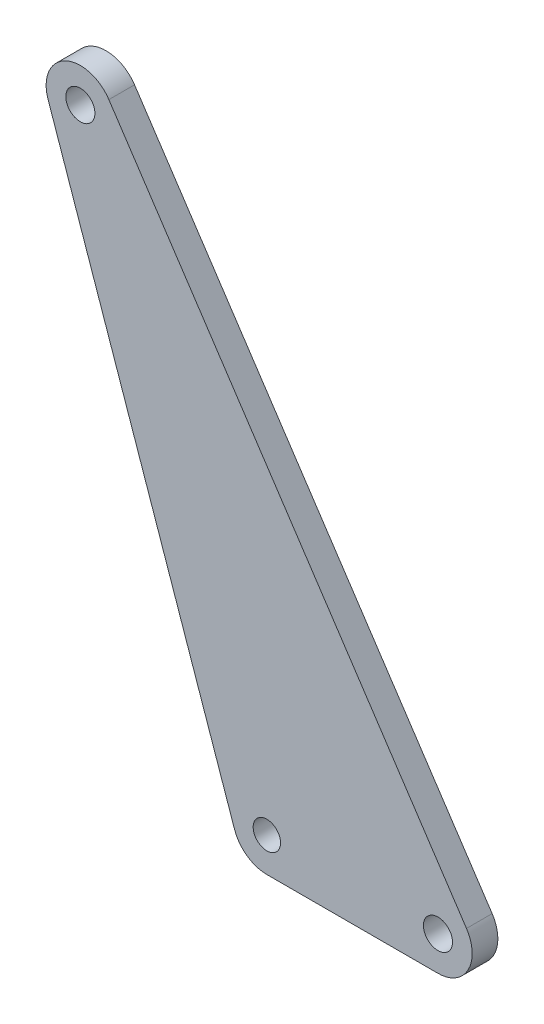
from build123d import *

# Parameters (mm, degrees)
SKETCH_1_R      = 1.6
SKETCH_1_R_2    = 1.7
SKETCH_1_R_3    = 4
EXTRUDE_1_DEPTH = 3


with BuildPart() as part:
    # 草图1 → 凸台-拉伸1 (new body)
    # profile 1 of 3: a face of its own
    with BuildSketch(Plane.XY):
        with BuildLine():
            Line((-2.4830952, 4), (-22.4830952, 4))
            ThreePointArc((-22.4830952, 4), (-25.741324807, 2.320331836), (-26.263182143, -1.308030085))
            ThreePointArc((-26.263182143, -1.308030085), (-24.803427036, -3.258229607), (-22.4830952, -4))
            Line((-22.4830952, -4), (-2.4830952, -4))
            ThreePointArc((-2.4830952, -4), (1.041523919, -1.891311732), (0.849981545, 2.211469967))
            ThreePointArc((0.849981545, 2.211469967), (-0.591783468, 3.524619119), (-2.4830952, 4))
        make_face()
        with Locations((-22.4830952, 0)):
            Circle(SKETCH_1_R, mode=Mode.SUBTRACT)
        with Locations((-2.4830952, 0)):
            Circle(SKETCH_1_R_2, mode=Mode.SUBTRACT)
    # profile 2 of 3: a face of its own
    with BuildSketch(Plane.XY):
        with BuildLine():
            ThreePointArc((-26.263182143, -1.308030085), (-25.741324807, 2.320331836), (-22.4830952, 4))
            Line((-22.4830952, 4), (-2.4830952, 4))
            ThreePointArc((-2.4830952, 4), (-0.591783468, 3.524619119), (0.849981545, 2.211469967))
            Line((0.849981545, 2.211469967), (-40.950018455, 65.211469967))
            ThreePointArc((-40.950018455, 65.211469967), (-40.453453769, 64.154922729), (-40.2830952, 63))
            ThreePointArc((-40.2830952, 63), (-43.619901326, 59.055361374), (-48.063182143, 61.691969915))
            Line((-48.063182143, 61.691969915), (-26.263182143, -1.308030085))
        make_face()
    # profile 3 of 3: a face of its own
    with BuildSketch(Plane.XY):
        with Locations((-44.2830952, 63)):
            Circle(SKETCH_1_R_3)
        with Locations((-44.2830952, 63)):
            Circle(SKETCH_1_R_2, mode=Mode.SUBTRACT)
    extrude(amount=EXTRUDE_1_DEPTH)


solid = part.part
